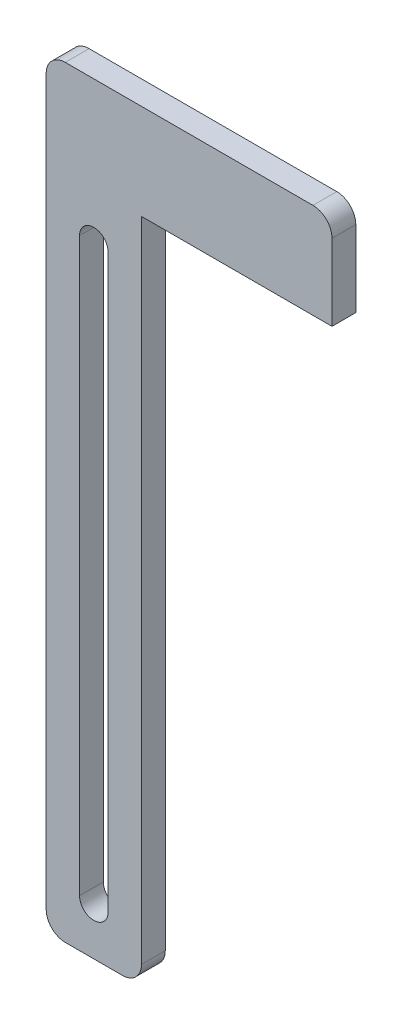
from build123d import *

# Parameters (mm, degrees)
BOSS_EXTRUDE1_DEPTH = 3.175
FILLET1_R           = 2.54


with BuildPart() as part:
    # Sketch1 → Boss-Extrude1 (new body)
    with BuildSketch(Plane.XY):
        Polygon((0, 101.6), (0, 0), (12.7, 0), (12.7, 88.9), (38.1, 88.9), (38.1, 101.6), align=None)
        with BuildLine():
            ThreePointArc((4.445, 82.55), (6.35, 84.455), (8.255, 82.55))
            Line((8.255, 82.55), (8.255, 6.35))
            ThreePointArc((8.255, 6.35), (6.35, 4.445), (4.445, 6.35))
            Line((4.445, 6.35), (4.445, 82.55))
        make_face(mode=Mode.SUBTRACT)
    extrude(amount=BOSS_EXTRUDE1_DEPTH)

    # Fillet1
    fillet1_edges = [part.edges().sort_by_distance(p)[0] for p in [
        (12.7, 0, 1.5875),
        (0, 0, 1.5875),
        (38.1, 101.6, 1.5875),
        (0, 101.6, 1.5875),
    ]]
    fillet(fillet1_edges, radius=FILLET1_R)


solid = part.part
